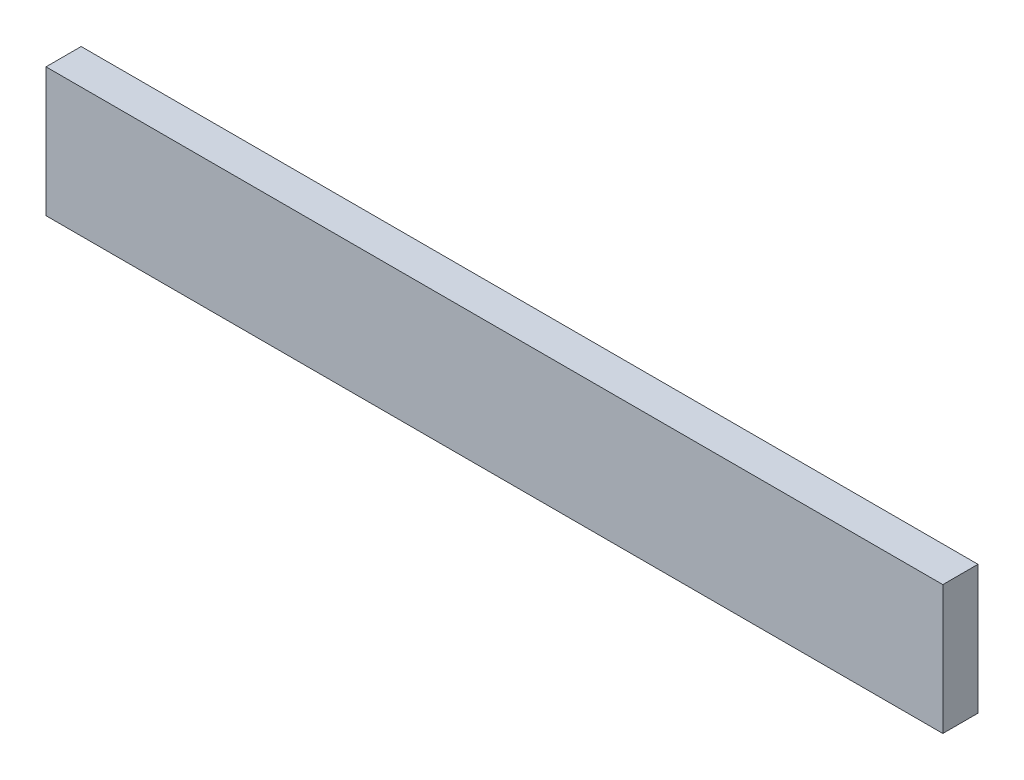
from build123d import *

# Parameters (mm, degrees)
SKETCH_1_W          = 153
SKETCH_1_H          = 22
SEAT_TO_FRAME_DEPTH = 6


with BuildPart() as part:
    # 草图1 → Seat_to_frame (new body)
    with BuildSketch(Plane.XY):
        with Locations((76.5, 11)):
            Rectangle(SKETCH_1_W, SKETCH_1_H)
    extrude(amount=SEAT_TO_FRAME_DEPTH)


solid = part.part
